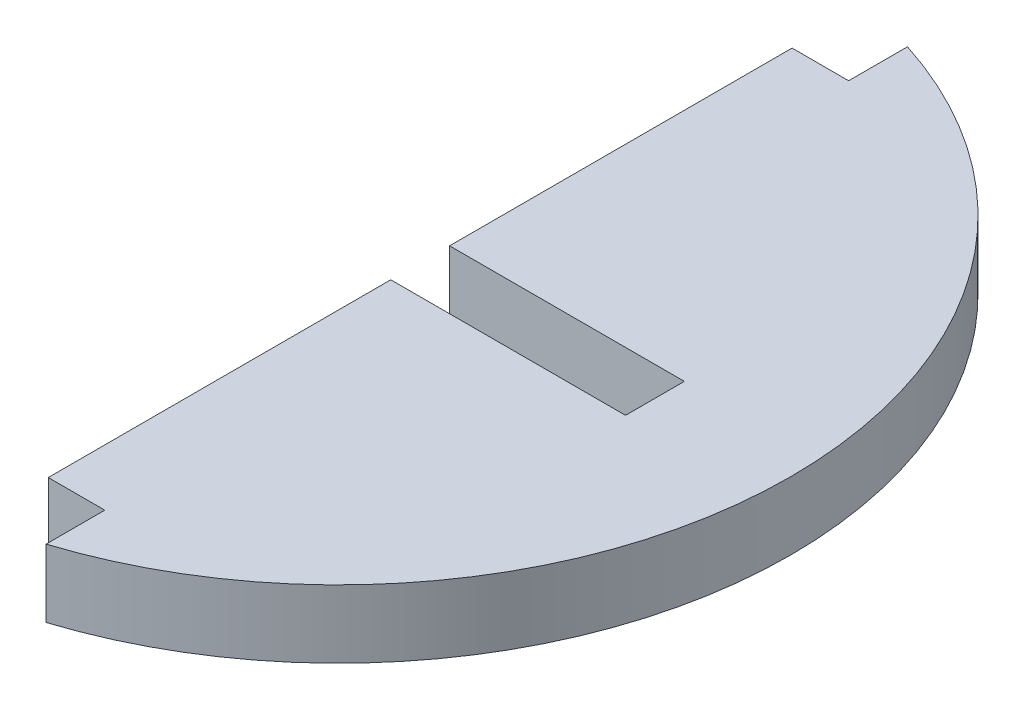
from build123d import *

# Parameters (mm, degrees)
BOSS_EXTRUDE1_DEPTH      = 1.5
BOSS_EXTRUDE1_DEPTH_BACK = 1.5


with BuildPart() as part:
    # Sketch1 → Boss-Extrude1 (new, two sides: drawn at the far end of the back side and taken through both)
    with BuildSketch(Plane(origin=(0, 0, 0), x_dir=(1, 0, 0), z_dir=(0, 1, 0)).offset(-BOSS_EXTRUDE1_DEPTH_BACK)):
        with BuildLine():
            Line((3.621320344, -1.3), (14, -1.3))
            Line((14, -1.3), (14, 1.3))
            Line((14, 1.3), (3.621320344, 1.3))
            Line((3.621320344, 1.3), (3.621320344, 16.440205809))
            Line((3.621320344, 16.440205809), (6.121320344, 16.440205809))
            Line((6.121320344, 16.440205809), (6.121320344, 19.040205809))
            ThreePointArc((6.121320344, 19.040205809), (20, 0), (6.121320344, -19.040205809))
            Line((6.121320344, -19.040205809), (6.121320344, -16.440205809))
            Line((6.121320344, -16.440205809), (3.621320344, -16.440205809))
            Line((3.621320344, -16.440205809), (3.621320344, -1.3))
        make_face()
    extrude(amount=BOSS_EXTRUDE1_DEPTH + BOSS_EXTRUDE1_DEPTH_BACK)


solid = part.part
